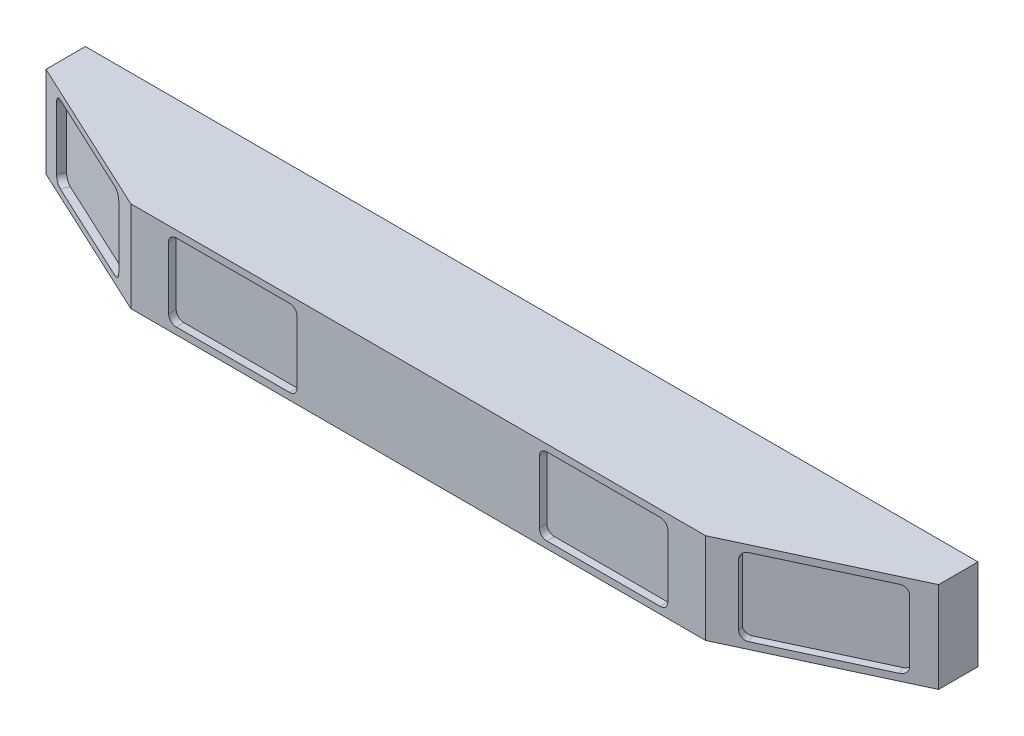
from build123d import *

# Parameters (mm, degrees)
SKETCH1_W           = 1180
SKETCH1_H           = 150
BOSS_EXTRUDE1_DEPTH = 120
SKETCH2_R           = 50
CUT_EXTRUDE1_DEPTH  = 50
CHAMFER1_SIZE       = 210
CHAMFER1_SIZE2      = 97.924608213
SKETCH3_W           = 170
SKETCH3_H           = 102
CUT_EXTRUDE2_DEPTH  = 10
FILLET2_R           = 10
SKETCH4_W           = 170
SKETCH4_H           = 102
CUT_EXTRUDE3_DEPTH  = 10
FILLET3_R           = 10
FILLET4_R           = 10


with BuildPart() as part:
    # Sketch1 → Boss-Extrude1 (new body)
    with BuildSketch(Plane(origin=(0, 0, 0), x_dir=(1, 0, 0), z_dir=(0, 1, 0))):
        with Locations((0, -75)):
            Rectangle(SKETCH1_W, SKETCH1_H)
    extrude(amount=-BOSS_EXTRUDE1_DEPTH)

    # Sketch2 → Cut-Extrude1 (cut)
    with BuildSketch(Plane(origin=(0, 0, 0), x_dir=(-1, 0, 0), z_dir=(0, 0, -1))):
        with Locations((-515, -60)):
            Circle(SKETCH2_R)
        with Locations((515, -60)):
            Circle(SKETCH2_R)
    extrude(amount=-CUT_EXTRUDE1_DEPTH, mode=Mode.SUBTRACT)

    # Chamfer1
    chamfer1_edges = [part.edges().sort_by_distance(p)[0] for p in [
        (590, -60, 150),
        (-590, -60, 150),
    ]]
    chamfer1_side = [part.faces().sort_by_distance(p)[0] for p in [
        (0, -60, 150),
    ]]
    chamfer(chamfer1_edges, length=CHAMFER1_SIZE, length2=CHAMFER1_SIZE2, reference=chamfer1_side[0])

    # Sketch3 → Cut-Extrude2 (cut)
    with BuildSketch(Plane(origin=(-125.323687393, 0, 268.757514919), x_dir=(0.9063077870366509, 0, 0.42261826174069755), z_dir=(-0.4226182617406975, 0, 0.9063077870366508))):
        with Locations((-398.858582795, -60)):
            Rectangle(SKETCH3_W, SKETCH3_H)
    cut_extrude2 = extrude(amount=-CUT_EXTRUDE2_DEPTH, mode=Mode.SUBTRACT)

    # Fillet2
    fillet2_edges = [part.edges().sort_by_distance(p)[0] for p in [
        (-561.735397496, -111, 59.738502795),
        (-561.735397496, -9, 59.738502795),
        (-407.6630737, -9, 131.583607291),
        (-407.6630737, -111, 131.583607291),
    ]]
    fillet(fillet2_edges, radius=FILLET2_R)

    # Mirror1: Cut-Extrude2 across plane
    add(cut_extrude2.mirror(Plane(origin=(0, 0, 0), x_dir=(0, 0, 1), z_dir=(1, 0, 0))), mode=Mode.SUBTRACT)

    # Sketch4 → Cut-Extrude3 (cut)
    with BuildSketch(Plane.XY.offset(150)):
        with Locations((-245, -60)):
            Rectangle(SKETCH4_W, SKETCH4_H)
    cut_extrude3 = extrude(amount=-CUT_EXTRUDE3_DEPTH, mode=Mode.SUBTRACT)

    # Fillet3
    fillet3_edges = [part.edges().sort_by_distance(p)[0] for p in [
        (-330, -111, 145),
        (-330, -9, 145),
        (-160, -9, 145),
        (-160, -111, 145),
    ]]
    fillet(fillet3_edges, radius=FILLET3_R)

    # Mirror2: Cut-Extrude3 across plane
    add(cut_extrude3.mirror(Plane(origin=(0, 0, 0), x_dir=(0, 0, 1), z_dir=(1, 0, 0))), mode=Mode.SUBTRACT)

    # Fillet4
    fillet4_edges = [part.edges().sort_by_distance(p)[0] for p in [
        (330, -9, 145),
        (330, -111, 145),
        (160, -111, 145),
        (160, -9, 145),
        (561.735397496, -9, 59.738502795),
        (561.735397496, -111, 59.738502795),
        (407.6630737, -111, 131.583607291),
        (407.6630737, -9, 131.583607291),
    ]]
    fillet(fillet4_edges, radius=FILLET4_R)


solid = part.part
